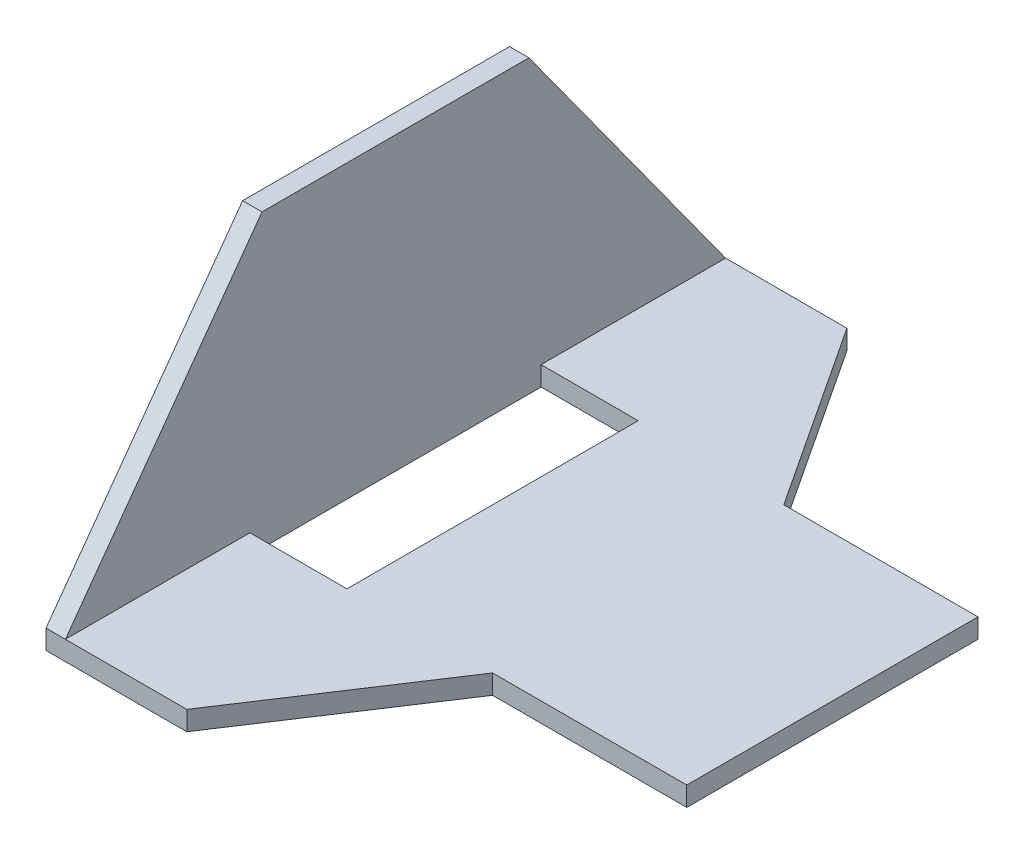
from build123d import *

# Parameters (mm, degrees)
BOSS_EXTRUDE1_DEPTH = 4
BOSS_EXTRUDE3_DEPTH = 4


with BuildPart() as part:
    # Sketch1 → Boss-Extrude1 (new body)
    with BuildSketch(Plane(origin=(0, 0, 0), x_dir=(1, 0, 0), z_dir=(0, 1, 0))):
        Polygon((-15, 30), (25, 30), (25, -30), (-15, -30), (-40, -68), (-65, -68), (-65, -30), (-45, -30), (-45, 30), (-65, 30), (-65, 68), (-40, 68), align=None)
    extrude(amount=BOSS_EXTRUDE1_DEPTH)

    # Sketch3 → Boss-Extrude3 (add)
    with BuildSketch(Plane.ZY.offset(65)):
        Polygon((-68, 0), (-68, 4), (-27.5, 60), (27.5, 60), (68, 4), (68, 0), align=None)
    extrude(amount=BOSS_EXTRUDE3_DEPTH)


solid = part.part
